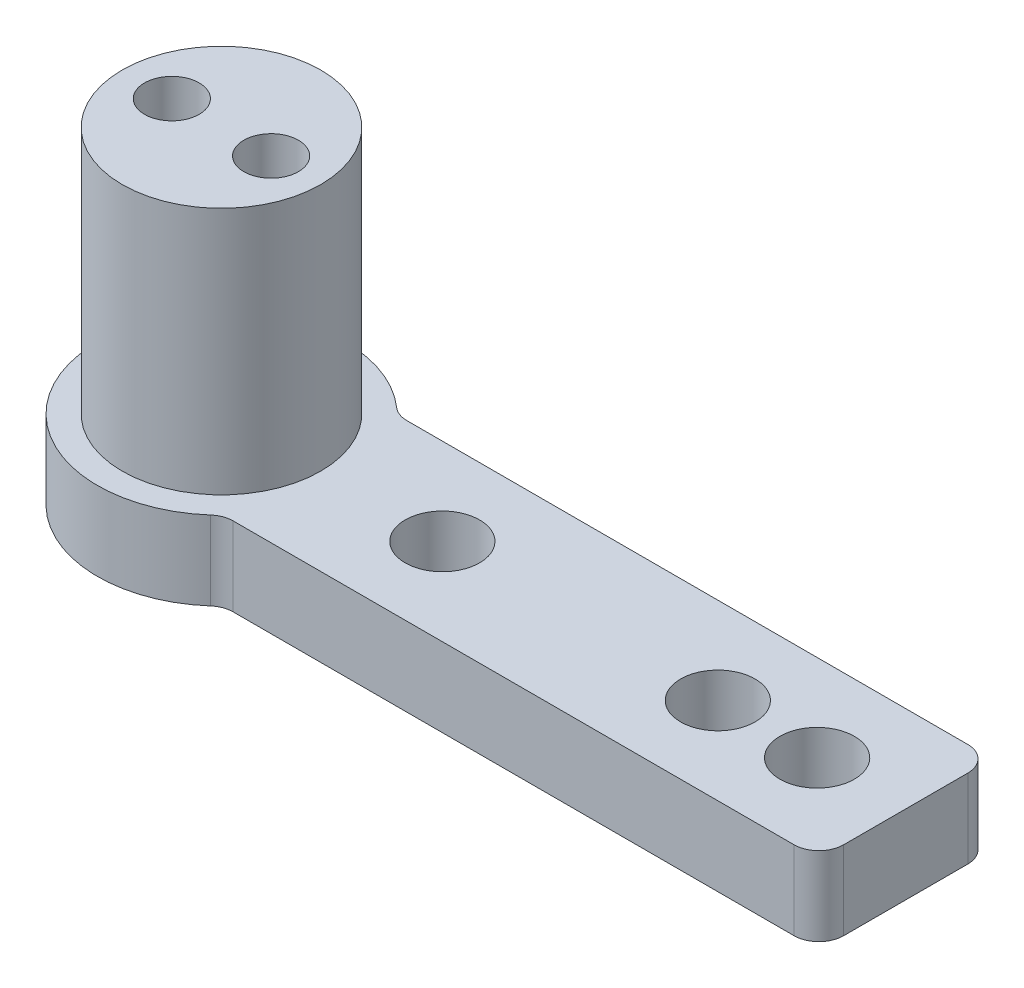
from build123d import *

# Parameters (mm, degrees)
SKETCH1_R           = 1.5
BOSS_EXTRUDE1_DEPTH = 3.175
SKETCH2_R           = 4
BOSS_EXTRUDE2_DEPTH = 10
FILLET1_R           = 1
SKETCH3_R           = 1.1
CUT_EXTRUDE1_DEPTH  = 5


with BuildPart() as part:
    # Sketch1 → Boss-Extrude1 (new body)
    with BuildSketch(Plane(origin=(0, 0, 0), x_dir=(1, 0, 0), z_dir=(0, 1, 0))):
        with BuildLine():
            Line((3.570714214, 3.5), (27.570714214, 3.5))
            Line((27.570714214, 3.5), (27.570714214, -3.5))
            Line((27.570714214, -3.5), (3.570714214, -3.5))
            ThreePointArc((3.570714214, -3.5), (-5, 0), (3.570714214, 3.5))
        make_face()
        with Locations(Location((8.9, 0, 0), (0, 0, 270))):
            Circle(SKETCH1_R, mode=Mode.SUBTRACT)
        with Locations(Location((20, 0, 0), (0, 0, 270))):
            Circle(SKETCH1_R, mode=Mode.SUBTRACT)
        with Locations(Location((24, 0, 0), (0, 0, 270))):
            Circle(SKETCH1_R, mode=Mode.SUBTRACT)
    extrude(amount=BOSS_EXTRUDE1_DEPTH)

    # Sketch2 → Boss-Extrude2 (add)
    with BuildSketch(Plane(origin=(0, 3.175, 0), x_dir=(1, 0, 0), z_dir=(0, 1, 0))):
        with Locations(Location((0, 0, 0), (0, 0, 270))):
            Circle(SKETCH2_R)
    extrude(amount=BOSS_EXTRUDE2_DEPTH)

    # Fillet1
    fillet1_edges = [part.edges().sort_by_distance(p)[0] for p in [
        (27.570714214, 1.5875, 3.5),
        (3.570714214, 1.5875, 3.5),
        (3.570714214, 1.5875, -3.5),
        (27.570714214, 1.5875, -3.5),
    ]]
    fillet(fillet1_edges, radius=FILLET1_R)

    # Sketch3 → Cut-Extrude1 (cut)
    with BuildSketch(Plane(origin=(0, 13.175, 0), x_dir=(1, 0, 0), z_dir=(0, 1, 0))):
        with Locations(Location((2, 0, 0), (0, 0, 270))):
            Circle(SKETCH3_R)
        with Locations(Location((-2, 0, 0), (0, 0, 270))):
            Circle(SKETCH3_R)
    extrude(amount=-CUT_EXTRUDE1_DEPTH, mode=Mode.SUBTRACT)


solid = part.part
